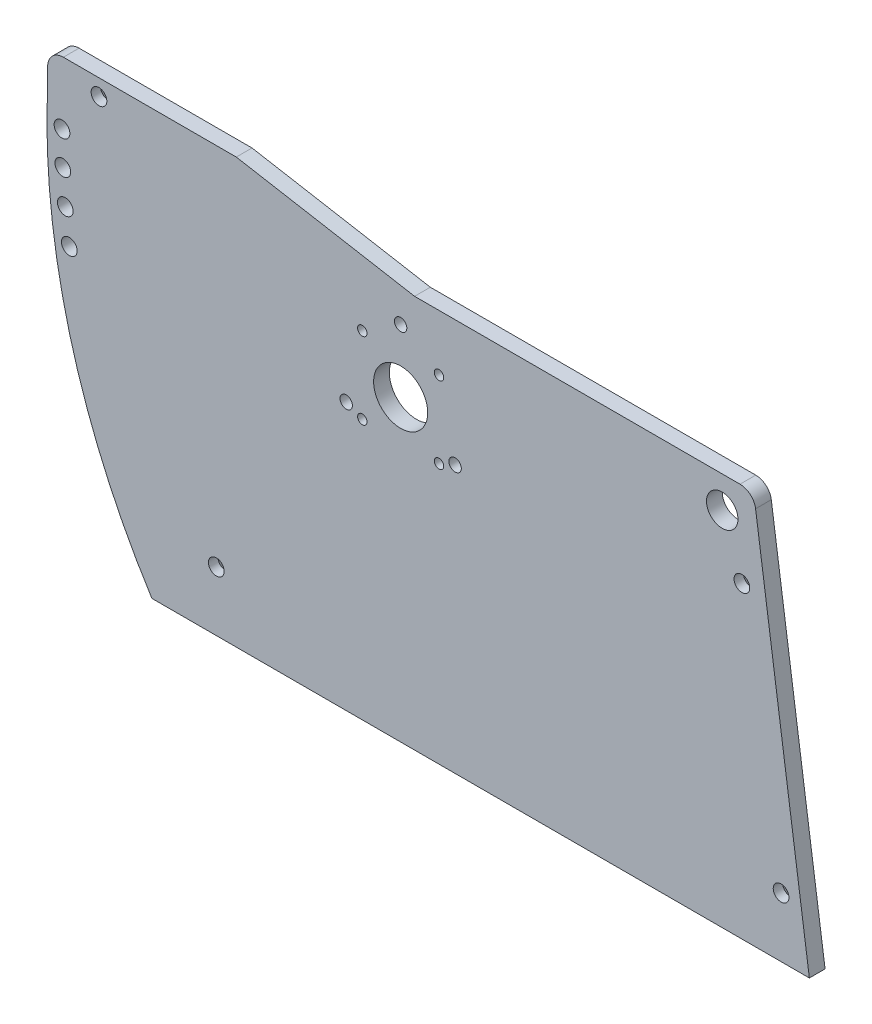
from build123d import *

# Parameters (mm, degrees)
SKETCH18_R          = 1.905
SKETCH18_R_2        = 3.175
SKETCH18_R_3        = 6.35
SKETCH18_R_4        = 2.5
SKETCH18_R_5        = 10.922
BOSS_EXTRUDE4_DEPTH = 6.35
CHAMFER1_SIZE       = 2.54


with BuildPart() as part:
    # Sketch18 → Boss-Extrude4 (new body)
    with BuildSketch(Plane.XY):
        with BuildLine():
            Line((0, 0), (-265.604745697, 0))
            ThreePointArc((-265.604745697, 0), (-298.882523776, 76.131915965), (-307.699061234, 158.75))
            Line((-307.699061234, 158.75), (-307.699061234, 165.1))
            ThreePointArc((-307.699061234, 165.1), (-305.839189294, 169.590128061), (-301.349061234, 171.45))
            Line((-301.349061234, 171.45), (-231.499061234, 171.45))
            Line((-231.499061234, 171.45), (-159.473782125, 158.75))
            Line((-159.473782125, 158.75), (-28.014368889, 158.75))
            ThreePointArc((-28.014368889, 158.75), (-23.851207857, 157.194850386), (-21.727208485, 153.291130779))
            Line((-21.727208485, 153.291130779), (0, 0))
        make_face()
        with Locations((-180.594, 136.144)):
            Circle(SKETCH18_R, mode=Mode.SUBTRACT)
        with Locations((-11.423473622, 24.034728138)):
            Circle(SKETCH18_R_2, mode=Mode.SUBTRACT)
        with Locations((-27.253356194, 124.406511892)):
            Circle(SKETCH18_R_2, mode=Mode.SUBTRACT)
        with Locations((-35.200938766, 146.05)):
            Circle(SKETCH18_R_3, mode=Mode.SUBTRACT)
        with Locations((-301.900938766, 146.05)):
            Circle(SKETCH18_R_2, mode=Mode.SUBTRACT)
        with Locations((-301.569673588, 132.761391752)):
            Circle(SKETCH18_R_2, mode=Mode.SUBTRACT)
        with Locations((-300.579872803, 119.537524267)):
            Circle(SKETCH18_R_2, mode=Mode.SUBTRACT)
        with Locations((-298.943543444, 106.442822899)):
            Circle(SKETCH18_R_2, mode=Mode.SUBTRACT)
        with Locations((-239.568937637, 24.034728138)):
            Circle(SKETCH18_R_2, mode=Mode.SUBTRACT)
        with Locations((-286.962142025, 164.850708953)):
            Circle(SKETCH18_R_2, mode=Mode.SUBTRACT)
        with Locations((-187.097045256, 107.95)):
            Circle(SKETCH18_R_4, mode=Mode.SUBTRACT)
        with Locations((-180.594, 105.156)):
            Circle(SKETCH18_R, mode=Mode.SUBTRACT)
        with Locations((-165.1, 120.65)):
            Circle(SKETCH18_R_5, mode=Mode.SUBTRACT)
        with Locations((-165.1, 146.05)):
            Circle(SKETCH18_R_4, mode=Mode.SUBTRACT)
        with Locations((-149.606, 105.156)):
            Circle(SKETCH18_R, mode=Mode.SUBTRACT)
        with Locations((-149.606, 136.144)):
            Circle(SKETCH18_R, mode=Mode.SUBTRACT)
        with Locations((-143.102954744, 107.95)):
            Circle(SKETCH18_R_4, mode=Mode.SUBTRACT)
    extrude(amount=BOSS_EXTRUDE4_DEPTH)

    # Chamfer1
    chamfer1_edges = [part.edges().sort_by_distance(p)[0] for p in [
        (-14.598473622, 24.034728138, 0),
        (-30.428356194, 124.406511892, 0),
        (-242.743937637, 24.034728138, 0),
        (-290.137142025, 164.850708953, 0),
    ]]
    chamfer(chamfer1_edges, length=CHAMFER1_SIZE)


solid = part.part
